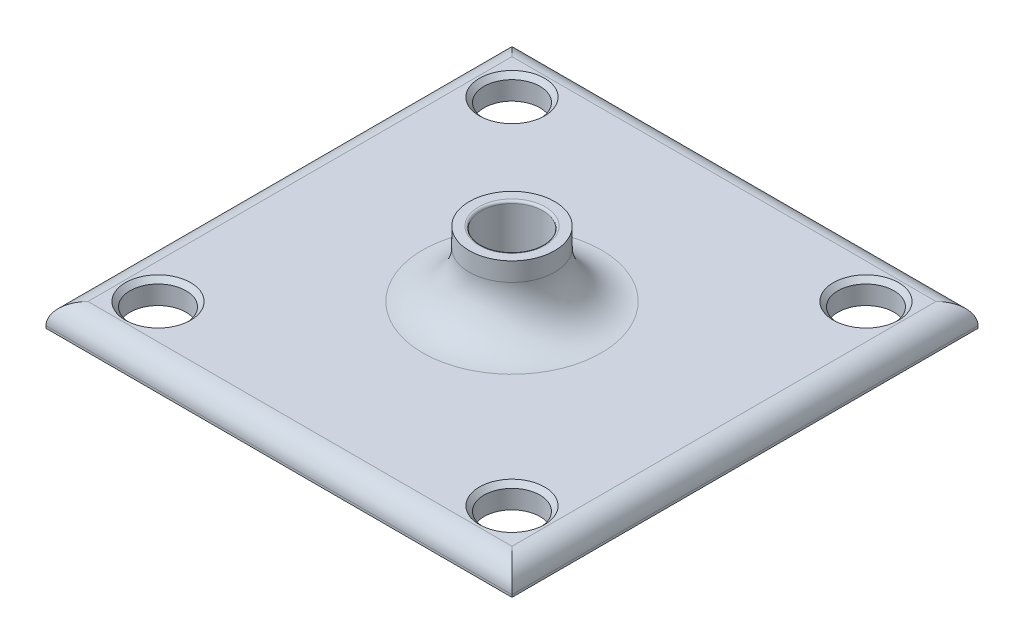
from build123d import *

# Parameters (mm, degrees)
SKETCH1_W           = 50
SKETCH1_H           = 50
BOSS_EXTRUDE1_DEPTH = 2.5
SKETCH2_R           = 1.525
CUT_EXTRUDE1_DEPTH  = 97.5
SKETCH6_R           = 3
CUT_EXTRUDE2_DEPTH  = 97.5
SKETCH7_R           = 4.575
SKETCH7_R_2         = 3.325
BOSS_EXTRUDE2_DEPTH = 7
FILLET1_R           = 5
FILLET2_R           = 2.25
CHAMFER1_SIZE       = 0.5
FILLET3_R           = 0.25


with BuildPart() as part:
    # Sketch1 → Boss-Extrude1 (new body)
    with BuildSketch(Plane(origin=(0, 0, 0), x_dir=(1, 0, 0), z_dir=(0, 1, 0))):
        Rectangle(SKETCH1_W, SKETCH1_H)
    extrude(amount=BOSS_EXTRUDE1_DEPTH)

    # Sketch2 → Cut-Extrude1 (cut)
    with BuildSketch(Plane(origin=(0, 2.5, 0), x_dir=(1, 0, 0), z_dir=(0, 1, 0))):
        with Locations(Location((0, 0, 0), (0, 0, 270))):
            Circle(SKETCH2_R)
    extrude(amount=-CUT_EXTRUDE1_DEPTH, mode=Mode.SUBTRACT)

    # Sketch6 → Cut-Extrude2 (cut)
    with BuildSketch(Plane(origin=(0, 2.5, 0), x_dir=(1, 0, 0), z_dir=(0, 1, 0))):
        with Locations(Location((-18.98959236, 18.98959236, 0), (0, 0, 270))):
            Circle(SKETCH6_R)
        with Locations(Location((18.98959236, 18.98959236, 0), (0, 0, 270))):
            Circle(SKETCH6_R)
        with Locations(Location((18.98959236, -18.98959236, 0), (0, 0, 270))):
            Circle(SKETCH6_R)
        with Locations(Location((-18.98959236, -18.98959236, 0), (0, 0, 270))):
            Circle(SKETCH6_R)
    extrude(amount=-CUT_EXTRUDE2_DEPTH, mode=Mode.SUBTRACT)

    # Sketch7 → Boss-Extrude2 (add)
    with BuildSketch(Plane(origin=(0, 2.5, 0), x_dir=(1, 0, 0), z_dir=(0, 1, 0))):
        with Locations(Location((0, 0, 0), (0, 0, 90))):
            Circle(SKETCH7_R)
        with Locations(Location((0, 0, 0), (0, 0, 270))):
            Circle(SKETCH7_R_2, mode=Mode.SUBTRACT)
    extrude(amount=BOSS_EXTRUDE2_DEPTH)

    # Fillet1
    fillet1_edges = [part.edges().sort_by_distance(p)[0] for p in [
        (0, 2.5, 4.575),
    ]]
    fillet(fillet1_edges, radius=FILLET1_R)

    # Fillet2
    fillet2_edges = [part.edges().sort_by_distance(p)[0] for p in [
        (-25, 2.5, 0),
        (0, 2.5, 25),
        (25, 2.5, 0),
        (0, 2.5, -25),
    ]]
    fillet(fillet2_edges, radius=FILLET2_R)

    # Chamfer1
    chamfer1_edges = [part.edges().sort_by_distance(p)[0] for p in [
        (-18.98959236, 2.5, 15.98959236),
        (18.98959236, 2.5, 15.98959236),
        (18.98959236, 2.5, -21.98959236),
        (-18.98959236, 2.5, -21.98959236),
    ]]
    chamfer(chamfer1_edges, length=CHAMFER1_SIZE)

    # Fillet3
    fillet3_edges = [part.edges().sort_by_distance(p)[0] for p in [
        (0, 9.5, -3.325),
    ]]
    fillet(fillet3_edges, radius=FILLET3_R)


solid = part.part
